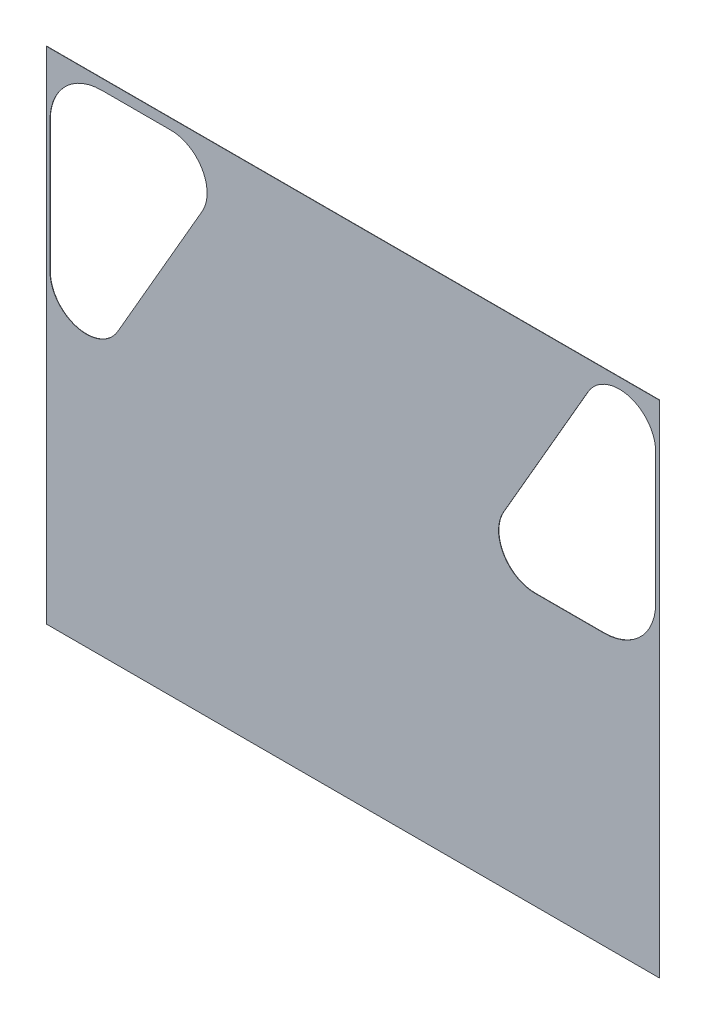
from build123d import *

# Parameters (mm, degrees)
SKETCH1_W           = 1991
SKETCH1_H           = 1625
BOSS_EXTRUDE1_DEPTH = 1
CUT_EXTRUDE1_DEPTH  = 2789.8673629


with BuildPart() as part:
    # Sketch1 → Boss-Extrude1 (new body)
    with BuildSketch(Plane.XY):
        with Locations((995.5, 812.5)):
            Rectangle(SKETCH1_W, SKETCH1_H)
    extrude(amount=BOSS_EXTRUDE1_DEPTH)

    # Sketch2 → Cut-Extrude1 (cut, through all)
    with BuildSketch(Plane(origin=(259.963517843, -561.616762327, 1), x_dir=(1, 0, 0), z_dir=(0, 0, 1))):
        with BuildLine():
            Line((1498.845356152, 2093.616540003), (1224.605356152, 1618.616540003))
            ThreePointArc((1224.605356152, 1618.616540003), (1224.605548691, 1500.616651165), (1326.796482157, 1441.616762327))
            Line((1326.796482157, 1441.616762327), (1551.036482157, 1441.616762327))
            ThreePointArc((1551.036482157, 1441.616762327), (1669.830421397, 1490.822823088), (1719.036482157, 1609.616762327))
            Line((1719.036482157, 1609.616762327), (1719.036482157, 2034.616762327))
            ThreePointArc((1719.036482157, 2034.616762327), (1631.577005494, 2148.596043051), (1498.845356152, 2093.616540003))
        make_face()
        with BuildLine():
            Line((-247.963517843, 1984.616762327), (-247.963517843, 1559.616762327))
            ThreePointArc((-247.963517843, 1559.616762327), (-160.504041179, 1445.637481603), (-27.772391837, 1500.616984652))
            Line((-27.772391837, 1500.616984652), (246.467608163, 1975.616984652))
            ThreePointArc((246.467608163, 1975.616984652), (246.467415624, 2093.61687349), (144.276482157, 2152.616762327))
            Line((144.276482157, 2152.616762327), (-79.963517843, 2152.616762327))
            ThreePointArc((-79.963517843, 2152.616762327), (-198.757457082, 2103.410701567), (-247.963517843, 1984.616762327))
        make_face()
    extrude(amount=-CUT_EXTRUDE1_DEPTH, mode=Mode.SUBTRACT)


solid = part.part
